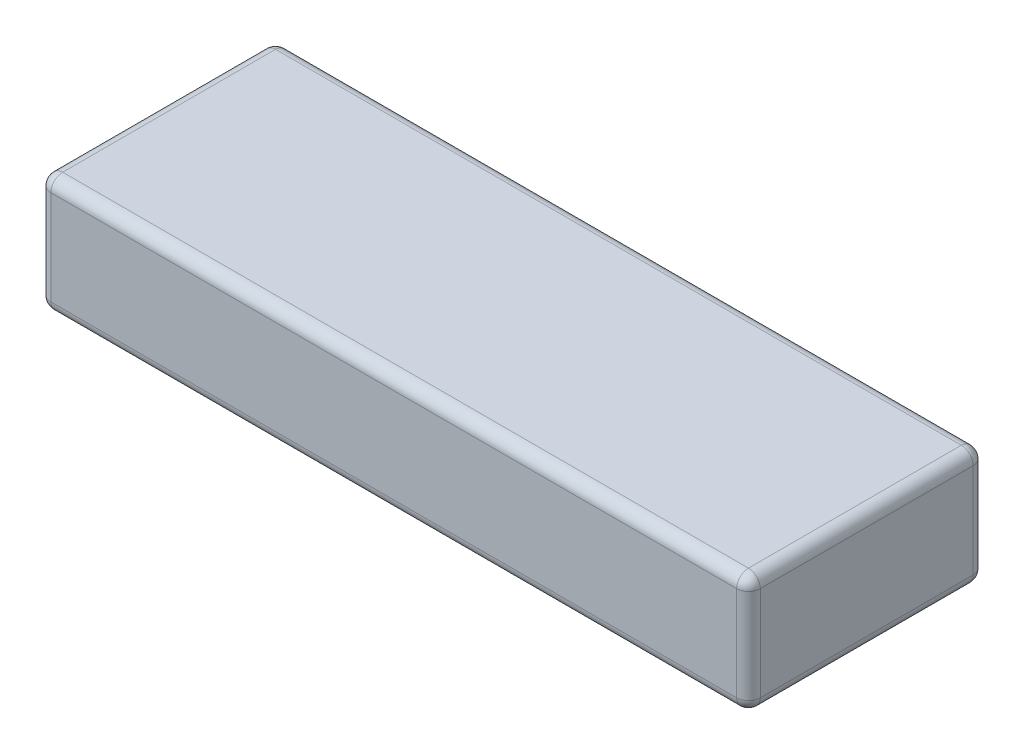
from build123d import *

# Parameters (mm, degrees)
SKETCH1_W           = 30
SKETCH1_H           = 10
BOSS_EXTRUDE1_DEPTH = 5
FILLET1_R           = 0.5


with BuildPart() as part:
    # Sketch1 → Boss-Extrude1 (new body)
    with BuildSketch(Plane(origin=(0, 0, 0), x_dir=(1, 0, 0), z_dir=(0, 1, 0))):
        Rectangle(SKETCH1_W, SKETCH1_H)
    extrude(amount=BOSS_EXTRUDE1_DEPTH)

    # Fillet1
    fillet1_edges = [part.edges().sort_by_distance(p)[0] for p in [
        (-15, 5, 0),
        (0, 5, 5),
        (15, 5, 0),
        (0, 0, 5),
        (-15, 0, 0),
        (0, 0, -5),
        (15, 0, 0),
        (15, 2.5, 5),
        (-15, 2.5, 5),
        (-15, 2.5, -5),
        (15, 2.5, -5),
        (0, 5, -5),
    ]]
    fillet(fillet1_edges, radius=FILLET1_R)


solid = part.part
